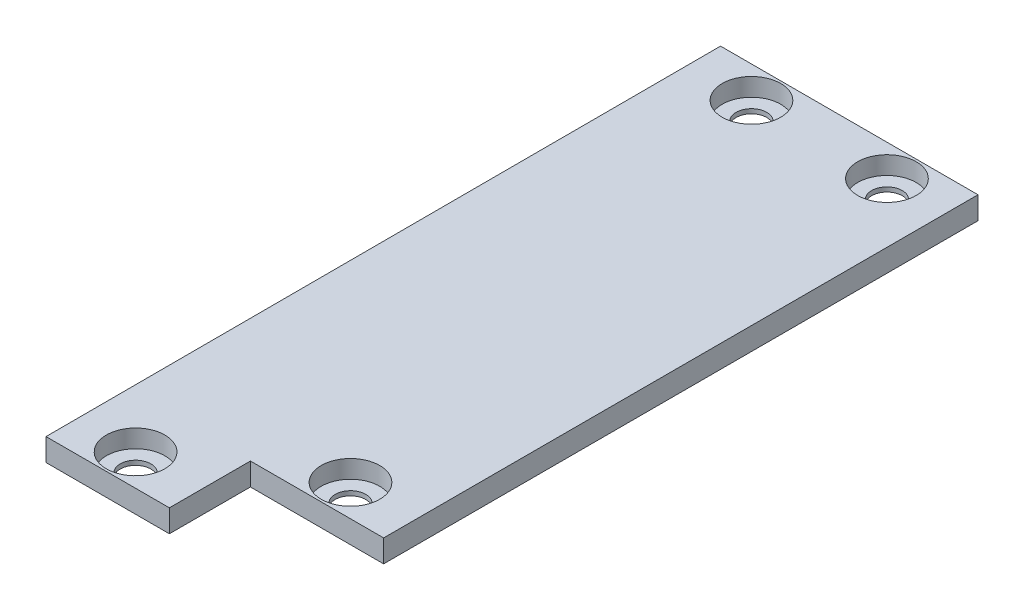
from build123d import *

# Parameters (mm, degrees)
BOSS_EXTRUDE1_DEPTH                         = 2.5
CBORE_FOR_M3_CHEESE_HEAD_SCREW1_D           = 3.4
CBORE_FOR_M3_CHEESE_HEAD_SCREW1_CBORE_D     = 6.5
CBORE_FOR_M3_CHEESE_HEAD_SCREW1_CBORE_DEPTH = 2
CUT_EXTRUDE1_DEPTH                          = 10
SKETCH6_W                                   = 14.59
SKETCH6_H                                   = 0.5
CUT_EXTRUDE2_DEPTH                          = 10
CUT_EXTRUDE3_DEPTH                          = 10
SKETCH8_W                                   = 0.2
SKETCH8_H                                   = 9.000000433
CUT_EXTRUDE4_DEPTH                          = 10


with BuildPart() as part:
    # Sketch1 → Boss-Extrude1 (new body)
    with BuildSketch(Plane(origin=(0, 0, 0), x_dir=(1, 0, 0), z_dir=(0, 1, 0))):
        Polygon((0, 0), (13.9, 0), (13.9, 9), (28.49, 9), (28.49, 76), (-0.1, 76), align=None)
    extrude(amount=BOSS_EXTRUDE1_DEPTH)

    # CBORE for M3 Cheese Head Screw1 (through all)
    with Locations(Plane(origin=(0, 2.5, 0), x_dir=(1, 0, 0), z_dir=(0, 1, 0))):
        with Locations((6.835263153, 72.000003463), (21.88, 72.000003463), (21.31, 13), (6.444736847, 3.999996537)):
            CounterBoreHole(CBORE_FOR_M3_CHEESE_HEAD_SCREW1_D / 2, CBORE_FOR_M3_CHEESE_HEAD_SCREW1_CBORE_D / 2, CBORE_FOR_M3_CHEESE_HEAD_SCREW1_CBORE_DEPTH)

    # Sketch5 → Cut-Extrude1 (cut)
    with BuildSketch(Plane(origin=(0, 2.5, 0), x_dir=(1, 0, 0), z_dir=(0, 1, 0))):
        Polygon((-0.1, 76), (-0.099342106, 75.500000433), (28.49, 75.500000433), (28.49, 76), align=None)
    extrude(amount=-CUT_EXTRUDE1_DEPTH, mode=Mode.SUBTRACT)

    # Sketch6 → Cut-Extrude2 (cut)
    with BuildSketch(Plane(origin=(0, 2.5, 0), x_dir=(1, 0, 0), z_dir=(0, 1, 0))):
        with Locations((21.195, 9.25)):
            Rectangle(SKETCH6_W, SKETCH6_H)
    extrude(amount=-CUT_EXTRUDE2_DEPTH, mode=Mode.SUBTRACT)

    # Sketch7 → Cut-Extrude3 (cut)
    with BuildSketch(Plane(origin=(0, 2.5, 0), x_dir=(1, 0, 0), z_dir=(0, 1, 0))):
        Polygon((13.9, 0), (13.9, 0.499999567), (-0.000657894, 0.499999567), (0, 0), align=None)
    extrude(amount=-CUT_EXTRUDE3_DEPTH, mode=Mode.SUBTRACT)

    # Sketch8 → Cut-Extrude4 (cut)
    with BuildSketch(Plane(origin=(0, 2.5, 0), x_dir=(1, 0, 0), z_dir=(0, 1, 0))):
        with Locations((13.8, 4.999999783)):
            Rectangle(SKETCH8_W, SKETCH8_H)
    extrude(amount=-CUT_EXTRUDE4_DEPTH, mode=Mode.SUBTRACT)


solid = part.part
